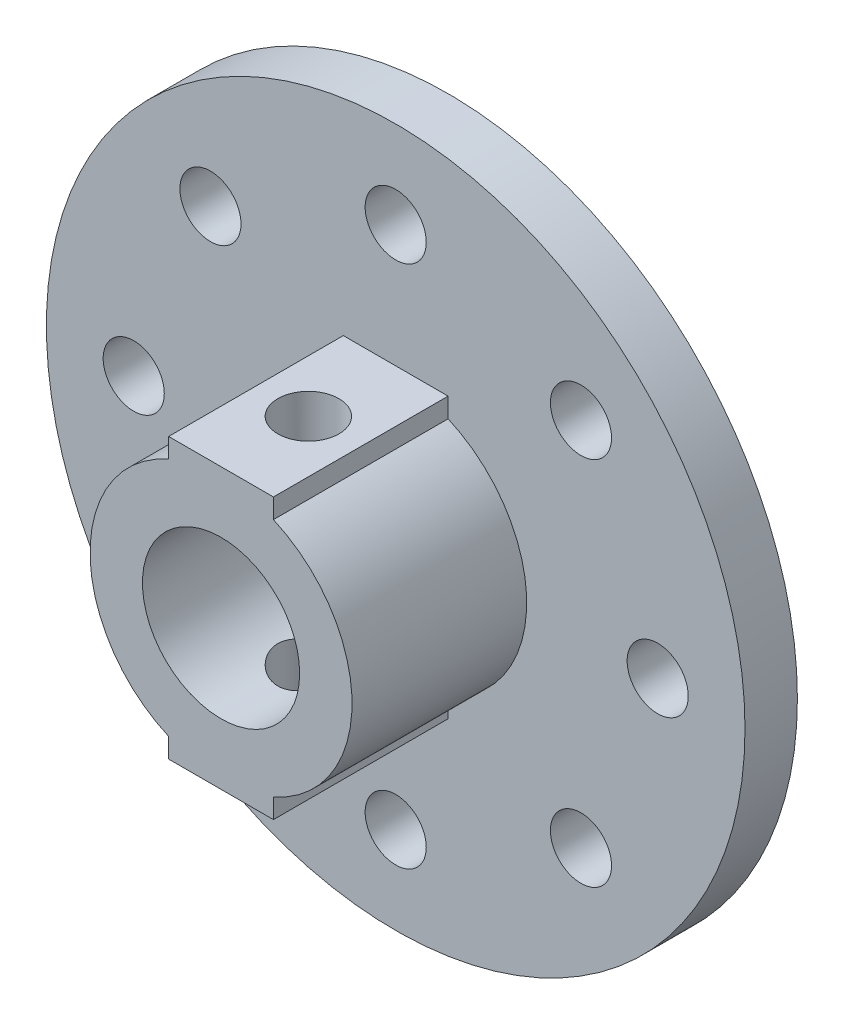
from build123d import *

# Parameters (mm, degrees)
SKETCH1_R               = 20
BOSS_EXTRUDE1_DEPTH     = 3
SKETCH2_R               = 7.5
BOSS_EXTRUDE2_DEPTH     = 10
SKETCH6_W               = 6
SKETCH6_H               = 16
BOSS_EXTRUDE3_DEPTH     = 10
SKETCH3_R               = 4.5
CUT_EXTRUDE1_DEPTH      = 32.128764833
SKETCH4_R               = 1.75
CUT_EXTRUDE2_DEPTH      = 31
CUT_EXTRUDE3_DEPTH      = 32.128764833
CUT_EXTRUDE3_DEPTH_BACK = 32.128764833
SKETCH5_R               = 1.75


with BuildPart() as part:
    # Sketch1 → Boss-Extrude1 (new body)
    with BuildSketch(Plane.XY):
        Circle(SKETCH1_R)
    extrude(amount=BOSS_EXTRUDE1_DEPTH)

    # Sketch2 → Boss-Extrude2 (add)
    with BuildSketch(Plane.XY.offset(3)):
        Circle(SKETCH2_R)
    extrude(amount=BOSS_EXTRUDE2_DEPTH)

    # Sketch6 → Boss-Extrude3 (add)
    with BuildSketch(Plane.XY.offset(3)):
        Rectangle(SKETCH6_W, SKETCH6_H)
    extrude(amount=BOSS_EXTRUDE3_DEPTH)

    # Sketch3 → Cut-Extrude1 (cut, through all)
    with BuildSketch(Plane.XY.offset(13)):
        Circle(SKETCH3_R)
    extrude(amount=-CUT_EXTRUDE1_DEPTH, mode=Mode.SUBTRACT)

    # Sketch4 → Cut-Extrude2 (cut, through all)
    with BuildSketch(Plane.XY.offset(3)):
        with Locations((0, 15)):
            Circle(SKETCH4_R)
        with Locations((10.606601718, 10.606601718)):
            Circle(SKETCH4_R)
        with Locations((15, 0)):
            Circle(SKETCH4_R)
        with Locations((10.606601718, -10.606601718)):
            Circle(SKETCH4_R)
        with Locations((0, -15)):
            Circle(SKETCH4_R)
        with Locations((-10.606601718, -10.606601718)):
            Circle(SKETCH4_R)
        with Locations((-15, 0)):
            Circle(SKETCH4_R)
        with Locations((-10.606601718, 10.606601718)):
            Circle(SKETCH4_R)
    extrude(amount=-CUT_EXTRUDE2_DEPTH, mode=Mode.SUBTRACT)

    # Sketch5 → Cut-Extrude3 (cut, two sides: drawn at the far end of the back side and taken through both)
    with BuildSketch(Plane(origin=(0, 0, 0), x_dir=(1, 0, 0), z_dir=(0, 1, 0)).offset(-CUT_EXTRUDE3_DEPTH_BACK)):
        with Locations(Location((0, -8, 0), (0, 0, 270))):
            Circle(SKETCH5_R)
    extrude(amount=CUT_EXTRUDE3_DEPTH + CUT_EXTRUDE3_DEPTH_BACK, mode=Mode.SUBTRACT)


solid = part.part
